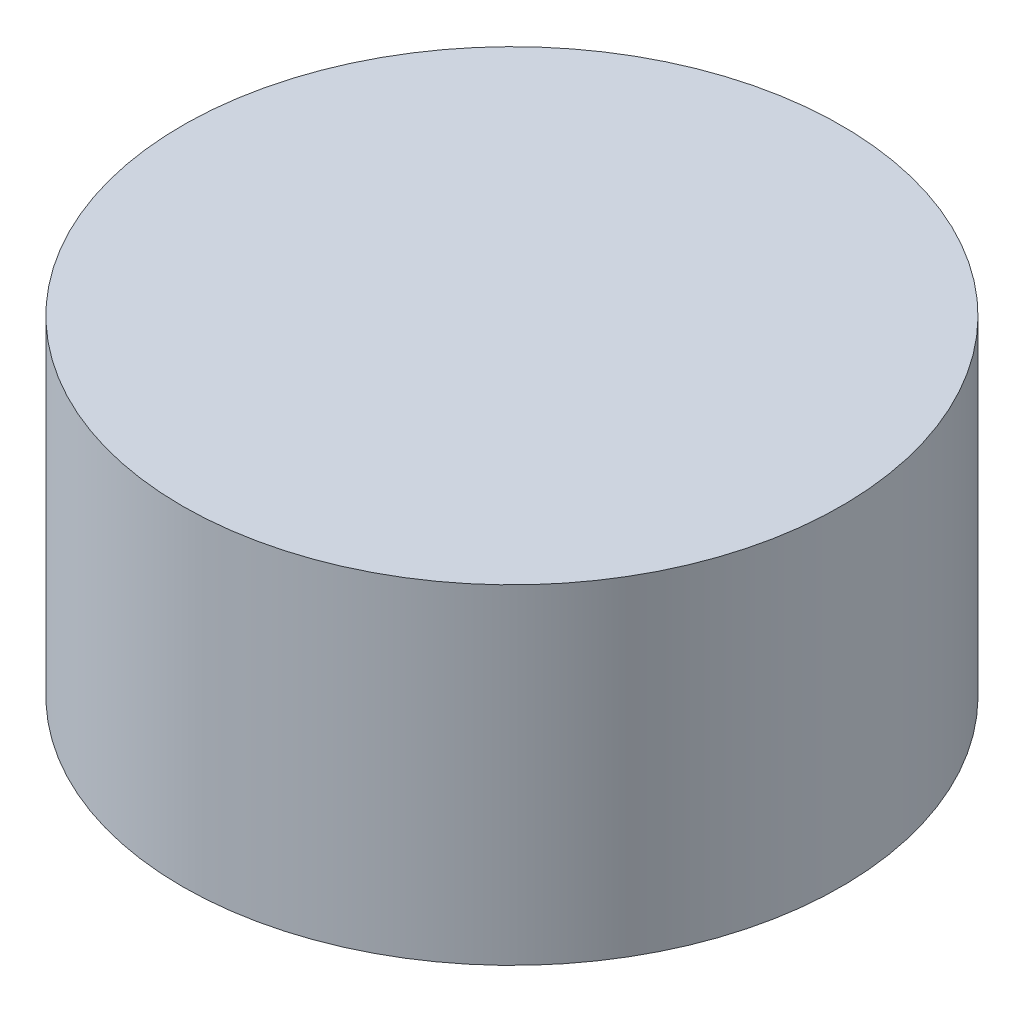
from build123d import *

# Parameters (mm, degrees)
SKETCH1_R           = 3.5
BOSS_EXTRUDE1_DEPTH = 3.5


with BuildPart() as part:
    # Sketch1 → Boss-Extrude1 (new body)
    with BuildSketch(Plane(origin=(0, 0, 0), x_dir=(1, 0, 0), z_dir=(0, 1, 0))):
        with Locations(Location((0, 0, 0), (0, 0, 270))):
            Circle(SKETCH1_R)
    extrude(amount=BOSS_EXTRUDE1_DEPTH)


solid = part.part
